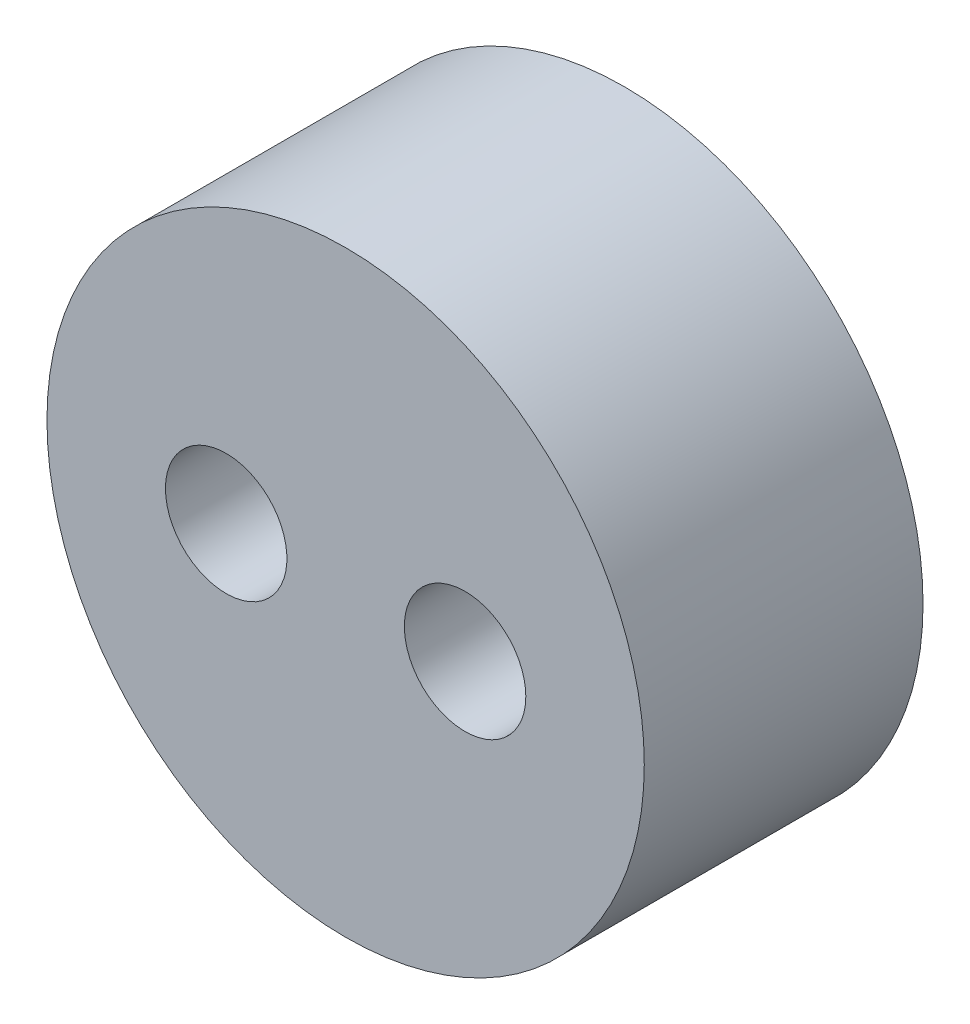
from build123d import *

# Parameters (mm, degrees)
SKETCH1_R           = 7.5
BOSS_EXTRUDE1_DEPTH = 7
SKETCH2_R           = 1.525
CUT_EXTRUDE1_DEPTH  = 13.708265027


with BuildPart() as part:
    # Sketch1 → Boss-Extrude1 (new body)
    with BuildSketch(Plane.XY):
        Circle(SKETCH1_R)
    extrude(amount=BOSS_EXTRUDE1_DEPTH)

    # Sketch2 → Cut-Extrude1 (cut, through all)
    with BuildSketch(Plane.XY.offset(7)):
        with Locations((3, 0)):
            Circle(SKETCH2_R)
        with Locations(Location((-3, 0, 0), (0, 0, 180))):
            Circle(SKETCH2_R)
    extrude(amount=-CUT_EXTRUDE1_DEPTH, mode=Mode.SUBTRACT)


solid = part.part
